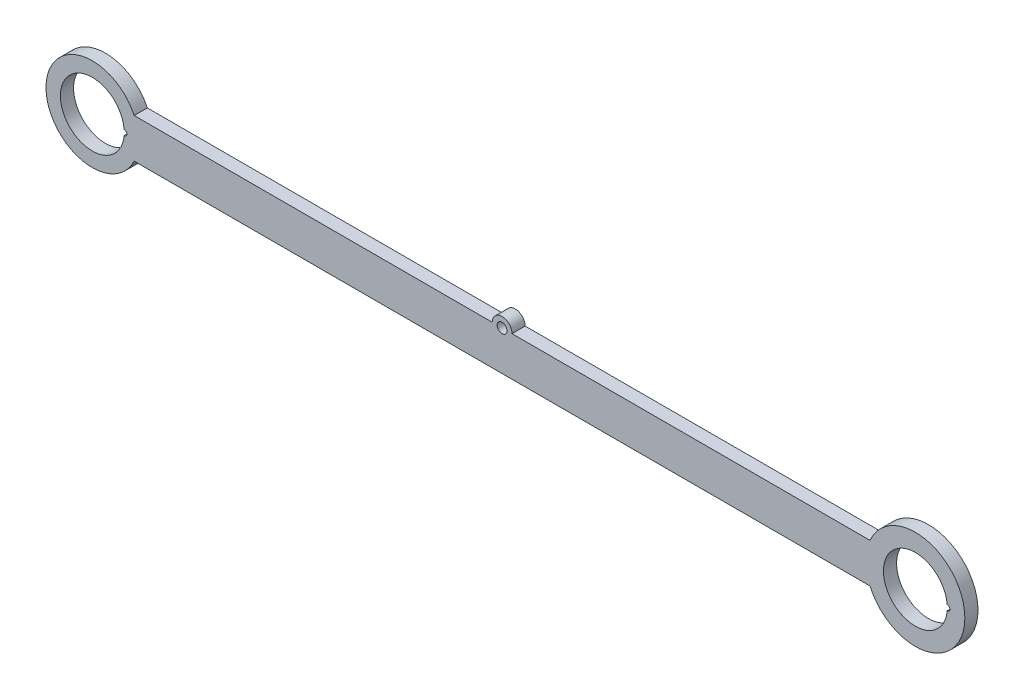
from build123d import *

# Parameters (mm, degrees)
SKETCH_1_R          = 9.7
SKETCH_1_R_2        = 1.5
EXTRUDE_1_DEPTH     = 4
SKETCH_3_R          = 0.8
CUT_EXTRUDE_1_DEPTH = 10


with BuildPart() as part:
    # 草图1 → 凸台-拉伸1 (new body)
    with BuildSketch(Plane.XY):
        with BuildLine():
            ThreePointArc((12.718684308, 6), (-14.062891969, 0), (12.718684308, -6))
            Line((12.718684308, -6), (236.224480753, -6))
            ThreePointArc((236.224480753, -6), (265.02547605, 0), (236.224480753, 6))
            Line((236.224480753, 6), (127.47158253, 6))
            ThreePointArc((127.47158253, 6), (124.47158253, 9), (121.47158253, 6))
            Line((121.47158253, 6), (12.718684308, 6))
        make_face()
        Circle(SKETCH_1_R, mode=Mode.SUBTRACT)
        with Locations((250, 0)):
            Circle(SKETCH_1_R, mode=Mode.SUBTRACT)
        with Locations((124.47158253, 6)):
            Circle(SKETCH_1_R_2, mode=Mode.SUBTRACT)
    extrude(amount=EXTRUDE_1_DEPTH)

    # 草图3 → 切除-拉伸1 (cut)
    with BuildSketch(Plane.XY.offset(4)):
        with Locations((9.7, 0)):
            Circle(SKETCH_3_R)
        with Locations((259.7, 0)):
            Circle(SKETCH_3_R)
    extrude(amount=-CUT_EXTRUDE_1_DEPTH, mode=Mode.SUBTRACT)


solid = part.part
